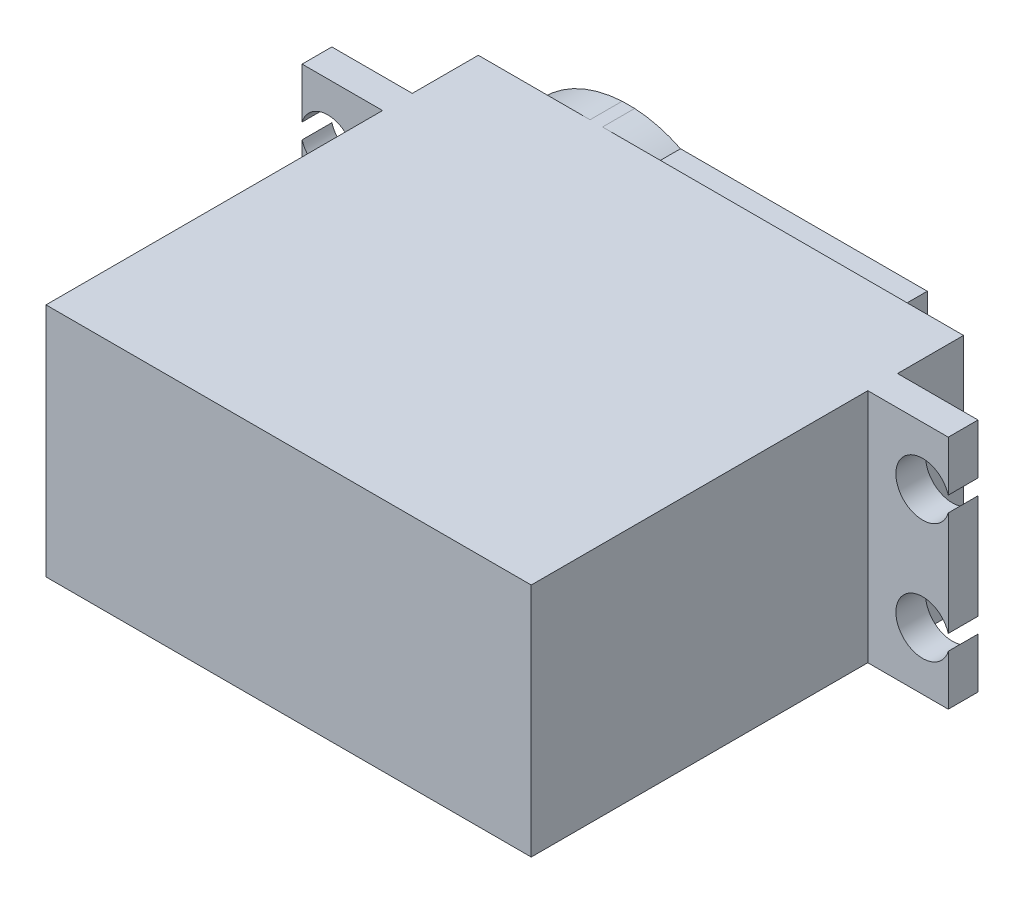
from build123d import *

# Parameters (mm, degrees)
BOSS_EXTRUDE1_DEPTH  = 19.812
SKETCH2_R            = 2.249999945
CUT_EXTRUDE1_DEPTH   = 46.597067399
BOSS_EXTRUDE2_DEPTH  = 2.699999934
SKETCH12_R           = 6.549999981
BOSS_EXTRUDE8_DEPTH  = 1.159999966
SKETCH13_R           = 5.334999998
BOSS_EXTRUDE9_DEPTH  = 0.65999995
SKETCH14_R           = 2.975000019
BOSS_EXTRUDE11_DEPTH = 4.000000128


with BuildPart() as part:
    # Sketch1 → Boss-Extrude1 (new body)
    with BuildSketch(Plane(origin=(0, 0, 0), x_dir=(1, 0, 0), z_dir=(0, 1, 0))):
        Polygon((-20.399999967, -18.174999972), (20.399999967, -18.174999972), (20.399999967, 10.124999816), (27.164999899, 10.124999816), (27.164999899, 12.624999896), (20.399999967, 12.624999896), (20.399999967, 18.174999972), (-20.399999967, 18.174999972), (-20.399999967, 12.624999896), (-27.164999899, 12.624999896), (-27.164999899, 10.124999816), (-20.399999967, 10.124999816), align=None)
    extrude(amount=BOSS_EXTRUDE1_DEPTH)

    # Sketch2 → Cut-Extrude1 (cut, through all)
    with BuildSketch(Plane(origin=(0, 0, -12.624999896), x_dir=(-1, 0, 0), z_dir=(0, 0, -1))):
        with Locations((25.009999891, 4.869999912)):
            Circle(SKETCH2_R)
        with Locations((25.009999891, 14.942000088)):
            Circle(SKETCH2_R)
        with Locations((-25.009999891, 4.869999912)):
            Circle(SKETCH2_R)
        with Locations((-25.009999891, 14.942000088)):
            Circle(SKETCH2_R)
    extrude(amount=-CUT_EXTRUDE1_DEPTH, mode=Mode.SUBTRACT)

    # Sketch3 → Boss-Extrude2 (add)
    with BuildSketch(Plane(origin=(0, 0, -18.174999972), x_dir=(-1, 0, 0), z_dir=(0, 0, -1))):
        with BuildLine():
            Line((-14.650000037, 18.80599998), (-14.650000037, 1.00600002))
            Line((-14.650000037, 1.00600002), (6.098630297, 1.00600002))
            ThreePointArc((6.098630297, 1.00600002), (0.559999979, 9.906), (6.098630297, 18.80599998))
            Line((6.098630297, 18.80599998), (-14.650000037, 18.80599998))
        make_face()
        with BuildLine():
            ThreePointArc((6.098630297, 18.80599998), (0.559999979, 9.906), (6.098630297, 1.00600002))
            ThreePointArc((6.098630297, 1.00600002), (7.974875683, 0.307523445), (9.953156655, 0))
            Line((9.953156655, 0), (11.006843291, 0))
            ThreePointArc((11.006843291, 0), (17.678356924, 3.08030904), (20.399999967, 9.906))
            ThreePointArc((20.399999967, 9.906), (17.678356924, 16.73169096), (11.006843291, 19.812))
            Line((11.006843291, 19.812), (9.953156655, 19.812))
            ThreePointArc((9.953156655, 19.812), (7.974875683, 19.504476555), (6.098630297, 18.80599998))
        make_face()
    extrude(amount=BOSS_EXTRUDE2_DEPTH)

    # Sketch12 → Boss-Extrude8 (add)
    with BuildSketch(Plane(origin=(0, 0, -20.874999906), x_dir=(-1, 0, 0), z_dir=(0, 0, -1))):
        with Locations((10.479999973, 9.906)):
            Circle(SKETCH12_R)
    extrude(amount=BOSS_EXTRUDE8_DEPTH)

    # Sketch13 → Boss-Extrude9 (add)
    with BuildSketch(Plane(origin=(0, 0, -22.034999872), x_dir=(-1, 0, 0), z_dir=(0, 0, -1))):
        with Locations(Location((10.479999973, 9.906, 0), (0, 0, 180))):
            Circle(SKETCH13_R)
    extrude(amount=BOSS_EXTRUDE9_DEPTH)

    # Sketch14 → Boss-Extrude11 (add)
    with BuildSketch(Plane(origin=(0, 0, -22.694999822), x_dir=(-1, 0, 0), z_dir=(0, 0, -1))):
        with Locations((10.479999973, 9.906)):
            Circle(SKETCH14_R)
    extrude(amount=BOSS_EXTRUDE11_DEPTH)


solid = part.part
